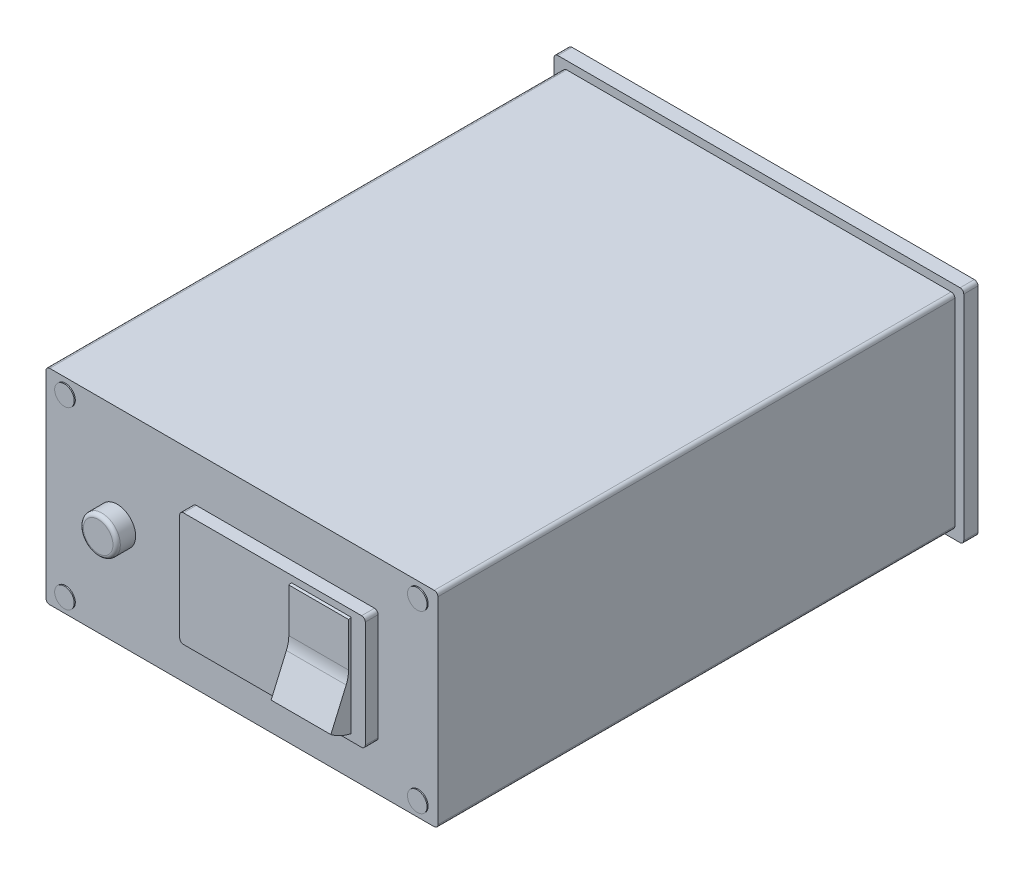
from build123d import *

# Parameters (mm, degrees)
SKETCH1_W               = 111.06
SKETCH1_H               = 59.85
FACE_2_DEPTH            = 3.86
FACE_FILLETS_R          = 1
SKETCH2_W               = 106.25
SKETCH2_H               = 55.5
BODY_DEPTH              = 144
SKETCH3_W               = 12.75
SKETCH3_H               = 12.75
FEET_DEPTH              = 3.33
FEET_DRAFT              = 25
FEET_PROFILE_2_DEPTH    = 3.33
FEET_PROFILE_2_DRAFT    = 25
FEET_PROFILE_3_DEPTH    = 3.33
FEET_PROFILE_3_DRAFT    = 25
FEET_PROFILE_4_DEPTH    = 3.33
FEET_PROFILE_4_DRAFT    = 25
BODY_FILLETS_R          = 1
SKETCH4_R               = 5
GND_BANNANA_PORT_DEPTH  = 5.15
FILLET3_R               = 1
SKETCH5_W               = 50.3
SKETCH5_H               = 30.9
POWER_PORT_DEPTH        = 3.5
FILLET4_R               = 1
BOSS_EXTRUDE6_DEPTH     = 8.1
SKETCH7_R               = 6.5
BOSS_EXTRUDE7_DEPTH     = 2.35
SKETCH8_R               = 2.65
BOSS_EXTRUDE8_DEPTH     = 0.3
MIRROR2_COPY_1_SKETCH_R = 2.65
MIRROR2_COPY_1_DEPTH    = 0.3


with BuildPart() as part:
    # Sketch1 → Face 2 (new body)
    with BuildSketch(Plane.XY):
        Rectangle(SKETCH1_W, SKETCH1_H)
    extrude(amount=FACE_2_DEPTH)

    # Face Fillets
    face_fillets_edges = [part.edges().sort_by_distance(p)[0] for p in [
        (55.53, -29.925, 1.93),
        (-55.53, -29.925, 1.93),
        (-55.53, 29.925, 1.93),
        (55.53, 29.925, 1.93),
    ]]
    fillet(face_fillets_edges, radius=FACE_FILLETS_R)

    # Sketch2 → Body (add)
    with BuildSketch(Plane.XY):
        Rectangle(SKETCH2_W, SKETCH2_H)
    extrude(amount=BODY_DEPTH)


with BuildPart() as feet_tool:
    # Sketch3 → Feet (with draft: the straight prism first)
    with BuildSketch(Plane.XZ.offset(27.75)):
        with Locations((-36.625, 125.75)):
            Rectangle(SKETCH3_W, SKETCH3_H)
    extrude(amount=FEET_DEPTH)
    # Feet: the draft: its side faces are tilted about the plane it starts from
    feet_sides = [feet_tool.faces().sort_by_distance(p)[0] for p in [
        (-36.625, -29.415, 119.375),
        (-30.25, -29.415, 125.75),
        (-36.625, -29.415, 132.125),
        (-43, -29.415, 125.75),
    ]]
    draft(feet_sides, Plane.XZ.offset(27.75), FEET_DRAFT)


with BuildPart() as part_1:
    add(part.part)

    # Feet: add feet_tool
    add(feet_tool.part)


with BuildPart() as feet_profile_2_tool:
    # Sketch3 → Feet profile 2 (with draft: the straight prism first)
    with BuildSketch(Plane.XZ.offset(27.75)):
        with Locations((36.625, 125.75)):
            Rectangle(SKETCH3_W, SKETCH3_H)
    extrude(amount=FEET_PROFILE_2_DEPTH)
    # Feet profile 2: the draft: its side faces are tilted about the plane it starts from
    feet_profile_2_sides = [feet_profile_2_tool.faces().sort_by_distance(p)[0] for p in [
        (36.625, -29.415, 119.375),
        (43, -29.415, 125.75),
        (36.625, -29.415, 132.125),
        (30.25, -29.415, 125.75),
    ]]
    draft(feet_profile_2_sides, Plane.XZ.offset(27.75), FEET_PROFILE_2_DRAFT)


with BuildPart() as part_2:
    add(part_1.part)

    # Feet profile 2: add feet_profile_2_tool
    add(feet_profile_2_tool.part)


with BuildPart() as feet_profile_3_tool:
    # Sketch3 → Feet profile 3 (with draft: the straight prism first)
    with BuildSketch(Plane.XZ.offset(27.75)):
        with Locations((36.625, 18.86)):
            Rectangle(SKETCH3_W, SKETCH3_H)
    extrude(amount=FEET_PROFILE_3_DEPTH)
    # Feet profile 3: the draft: its side faces are tilted about the plane it starts from
    feet_profile_3_sides = [feet_profile_3_tool.faces().sort_by_distance(p)[0] for p in [
        (36.625, -29.415, 12.485),
        (43, -29.415, 18.86),
        (36.625, -29.415, 25.235),
        (30.25, -29.415, 18.86),
    ]]
    draft(feet_profile_3_sides, Plane.XZ.offset(27.75), FEET_PROFILE_3_DRAFT)


with BuildPart() as part_3:
    add(part_2.part)

    # Feet profile 3: add feet_profile_3_tool
    add(feet_profile_3_tool.part)


with BuildPart() as feet_profile_4_tool:
    # Sketch3 → Feet profile 4 (with draft: the straight prism first)
    with BuildSketch(Plane.XZ.offset(27.75)):
        with Locations((-36.625, 18.86)):
            Rectangle(SKETCH3_W, SKETCH3_H)
    extrude(amount=FEET_PROFILE_4_DEPTH)
    # Feet profile 4: the draft: its side faces are tilted about the plane it starts from
    feet_profile_4_sides = [feet_profile_4_tool.faces().sort_by_distance(p)[0] for p in [
        (-36.625, -29.415, 12.485),
        (-30.25, -29.415, 18.86),
        (-36.625, -29.415, 25.235),
        (-43, -29.415, 18.86),
    ]]
    draft(feet_profile_4_sides, Plane.XZ.offset(27.75), FEET_PROFILE_4_DRAFT)


with BuildPart() as part_4:
    add(part_3.part)

    # Feet profile 4: add feet_profile_4_tool
    add(feet_profile_4_tool.part)

    # Body Fillets
    body_fillets_edges = [part_4.edges().sort_by_distance(p)[0] for p in [
        (53.125, -27.75, 73.93),
        (53.125, 27.75, 73.93),
        (-53.125, 27.75, 73.93),
        (-53.125, -27.75, 73.93),
    ]]
    fillet(body_fillets_edges, radius=BODY_FILLETS_R)

    # Sketch4 → GND Bannana Port (add)
    with BuildSketch(Plane.XY.offset(144)):
        with Locations(Location((-33.825, 0, 0), (0, 0, 180))):
            Circle(SKETCH4_R)
    extrude(amount=GND_BANNANA_PORT_DEPTH)

    # Fillet3
    fillet3_edges = [part_4.edges().sort_by_distance(p)[0] for p in [
        (-28.825, 0, 149.15),
    ]]
    fillet(fillet3_edges, radius=FILLET3_R)

    # Sketch5 → Power Port (add)
    with BuildSketch(Plane.XY.offset(144)):
        with Locations((11.775, 0)):
            Rectangle(SKETCH5_W, SKETCH5_H)
    extrude(amount=POWER_PORT_DEPTH)

    # Fillet4
    fillet4_edges = [part_4.edges().sort_by_distance(p)[0] for p in [
        (36.925, -15.45, 145.75),
        (36.925, 15.45, 145.75),
        (-13.375, 15.45, 145.75),
        (-13.375, -15.45, 145.75),
    ]]
    fillet(fillet4_edges, radius=FILLET4_R)

    # Sketch6 → Boss-Extrude6 (add, symmetric)
    with BuildSketch(Plane(origin=(25, 0, 0), x_dir=(0, 0, -1), z_dir=(1, 0, 0))):
        with BuildLine():
            Line((-148.2, 13.502222039), (-148.2, 1.62259302))
            ThreePointArc((-148.2, 1.62259302), (-148.366278541, 0), (-148.858202027, -1.55514242))
            Line((-148.858202027, -1.55514242), (-153, -11.124297731))
            ThreePointArc((-153, -11.124297731), (-130.758589265, -2.678363494), (-148.2, 13.502222039))
        make_face()
    extrude(amount=BOSS_EXTRUDE6_DEPTH, both=True)

    # Sketch7 → Boss-Extrude7 (add, symmetric)
    with BuildSketch(Plane(origin=(0, 0, 0), x_dir=(-1, 0, 0), z_dir=(0, 0, -1))):
        with Locations((-34.53, -2.925)):
            Circle(SKETCH7_R)
    extrude(amount=BOSS_EXTRUDE7_DEPTH, both=True)

    # Sketch8 → Boss-Extrude8 (add, symmetric)
    with BuildSketch(Plane.XY.offset(144)):
        with Locations(Location((-47.825, 23.75, 0), (0, 0, 180))):
            Circle(SKETCH8_R)
    boss_extrude8 = extrude(amount=BOSS_EXTRUDE8_DEPTH, both=True)

    # Mirror1: Boss-Extrude8 across plane
    add(boss_extrude8.mirror(Plane(origin=(0, 0, 0), x_dir=(0, 0, 1), z_dir=(1, 0, 0))))

    # Mirror2: Boss-Extrude8 across plane
    add(boss_extrude8.mirror(Plane.ZX))

    # Mirror2 copy 1 sketch → Mirror2 copy 1 (add, symmetric)
    with BuildSketch(Plane(origin=(0, 0, 144), x_dir=(-1, 0, 0), z_dir=(0, 0, 1))):
        with Locations(Location((-47.825, 23.75, 0), (0, 0, 180))):
            Circle(MIRROR2_COPY_1_SKETCH_R)
    extrude(amount=MIRROR2_COPY_1_DEPTH, both=True)


solid = part_4.part
